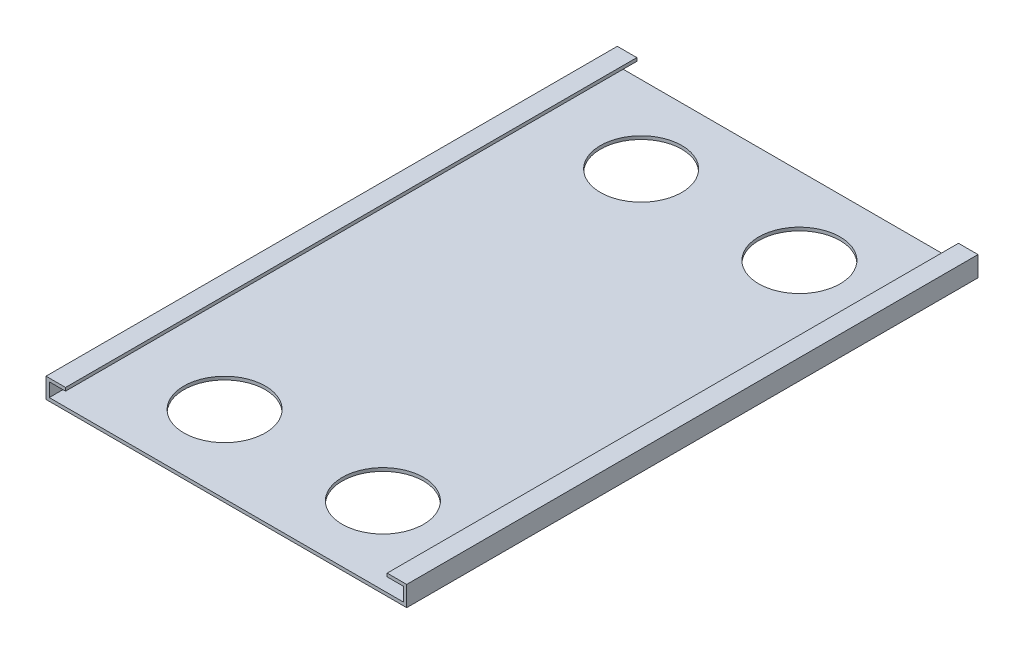
from build123d import *

# Parameters (mm, degrees)
EXTRUDE_THIN3_DEPTH     = 89.154
CUT_EXTRUDE1_DEPTH      = 94.54354816
CUT_EXTRUDE1_DEPTH_BACK = 94.54354816
SKETCH8_R               = 6.35


with BuildPart() as part:
    # Sketch6 → Extrude-Thin3 (new body)
    with BuildSketch(Plane.XY):
        Polygon((25.0952, 2.1336), (27.6352, 2.1336), (27.6352, 0), (-27.6352, 0), (-27.6352, 2.1336), (-25.0952, 2.1336), (-25.0952, 2.6416), (-28.1432, 2.6416), (-28.1432, -0.508), (28.1432, -0.508), (28.1432, 2.6416), (25.0952, 2.6416), align=None)
    extrude(amount=EXTRUDE_THIN3_DEPTH)

    # Sketch8 → Cut-Extrude1 (cut, two sides: drawn at the far end of the back side and taken through both)
    with BuildSketch(Plane.XZ.offset(0.508).offset(-CUT_EXTRUDE1_DEPTH_BACK)):
        with Locations(Location((12.35, 77.077, 0), (0, 0, 270))):
            Circle(SKETCH8_R)
        with Locations(Location((-12.35, 77.077, 0), (0, 0, 270))):
            Circle(SKETCH8_R)
        with Locations(Location((-12.35, 12.077, 0), (0, 0, 270))):
            Circle(SKETCH8_R)
        with Locations(Location((12.35, 12.077, 0), (0, 0, 270))):
            Circle(SKETCH8_R)
    extrude(amount=CUT_EXTRUDE1_DEPTH + CUT_EXTRUDE1_DEPTH_BACK, mode=Mode.SUBTRACT)


solid = part.part
